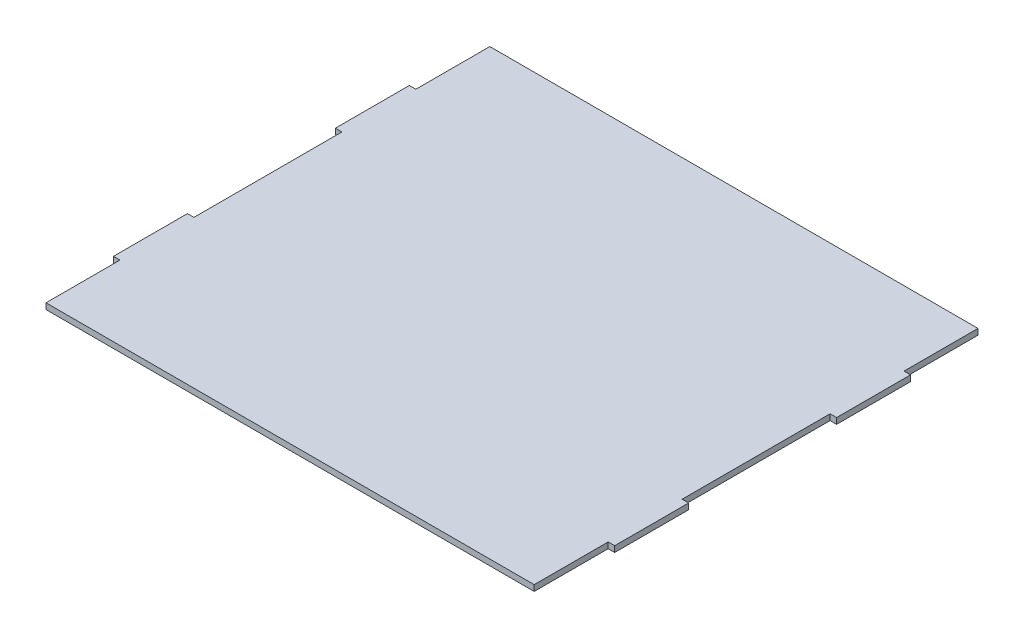
from build123d import *

# Parameters (mm, degrees)
SKETCH1_W           = 169.4
SKETCH1_H           = 150
BOSS_EXTRUDE1_DEPTH = 2
CUT_EXTRUDE1_DEPTH  = 2


with BuildPart() as part:
    # Sketch1 → Boss-Extrude1 (new body)
    with BuildSketch(Plane(origin=(0, 0, 0), x_dir=(1, 0, 0), z_dir=(0, 1, 0))):
        Rectangle(SKETCH1_W, SKETCH1_H)
    extrude(amount=BOSS_EXTRUDE1_DEPTH)

    # Sketch2 → Cut-Extrude1 (cut)
    with BuildSketch(Plane(origin=(0, 2, 0), x_dir=(1, 0, 0), z_dir=(0, 1, 0))):
        Polygon((82.5, -50), (82.5, -75), (87.923107592, -75), (87.923107592, 75), (82.5, 75), (82.5, 50), (84.7, 50), (84.7, 25), (82.5, 25), (82.5, -25), (84.7, -25), (84.7, -50), align=None)
        Polygon((-82.5, 50), (-82.5, 75), (-87.923107592, 75), (-87.923107592, -75), (-82.5, -75), (-82.5, -50), (-84.7, -50), (-84.7, -25), (-82.5, -25), (-82.5, 25), (-84.7, 25), (-84.7, 50), align=None)
    extrude(amount=-CUT_EXTRUDE1_DEPTH, mode=Mode.SUBTRACT)


solid = part.part
